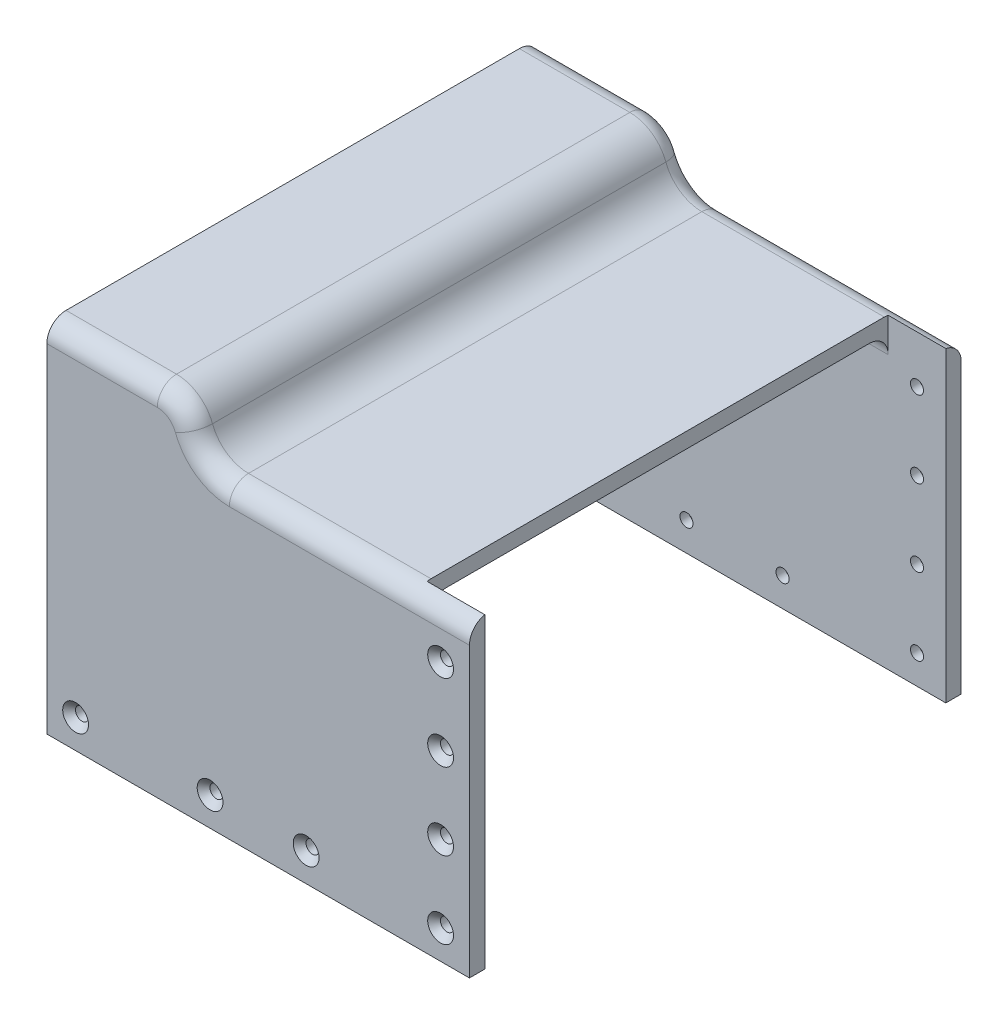
from build123d import *

# Parameters (mm, degrees)
BOSS_EXTRUDE1_DEPTH          = 64
SHELL1_T                     = -4
FILLET1_R                    = 10
FILLET2_R                    = 10
FILLET4_R                    = 10
FILLET6_R                    = 10
SKETCH3_W                    = 95
SKETCH3_H                    = 4
BOSS_EXTRUDE4_DEPTH          = 15
SKETCH4_W                    = 4
SKETCH4_H                    = 80
BOSS_EXTRUDE5_DEPTH          = 15
FILLET7_R                    = 5
FILLET8_R                    = 5
CSK_FOR_M3_SFHCS1_AT_2_COUNT = 2
CSK_FOR_M3_SFHCS1_AT_2_PITCH = 35
CSK_FOR_M3_SFHCS1_AT_3_COUNT = 2
CSK_FOR_M3_SFHCS1_AT_3_PITCH = 60
CSK_FOR_M3_SFHCS1_AT_4_COUNT = 2
CSK_FOR_M3_SFHCS1_AT_4_PITCH = 95
CSK_FOR_M3_SFHCS1_AT_5_COUNT = 2
CSK_FOR_M3_SFHCS1_AT_5_PITCH = 97.082439195
CSK_FOR_M3_SFHCS1_AT_6_COUNT = 2
CSK_FOR_M3_SFHCS1_AT_6_PITCH = 103.07764064
CSK_FOR_M3_SFHCS1_AT_7_COUNT = 2
CSK_FOR_M3_SFHCS1_AT_7_PITCH = 112.361025271


with BuildPart() as part:
    # Sketch1 → Boss-Extrude1 (new, symmetric)
    with BuildSketch(Plane.XY):
        Polygon((-47.5, -32.5), (47.5, -32.5), (47.5, 32.5), (-10, 32.5), (-10, 45.5), (-47.5, 45.5), (-47.5, 32.5), align=None)
    extrude(amount=BOSS_EXTRUDE1_DEPTH, both=True)

    # Shell1
    shell1_openings = [part.faces().sort_by_distance(p)[0] for p in [
        (47.5, 0, 0),
        (-47.5, 6.5, 0),
        (0, -32.5, 0),
    ]]
    offset(amount=SHELL1_T, openings=shell1_openings, kind=Kind.INTERSECTION)

    # Fillet1
    fillet1_edges = [part.edges().sort_by_distance(p)[0] for p in [
        (-10, 32.5, 0),
    ]]
    fillet(fillet1_edges, radius=FILLET1_R)

    # Fillet2
    fillet2_edges = [part.edges().sort_by_distance(p)[0] for p in [
        (-10, 45.5, 0),
    ]]
    fillet(fillet2_edges, radius=FILLET2_R)

    # Fillet4
    fillet4_edges = [part.edges().sort_by_distance(p)[0] for p in [
        (-14, 28.5, 0),
    ]]
    fillet(fillet4_edges, radius=FILLET4_R)

    # Fillet6
    fillet6_edges = [part.edges().sort_by_distance(p)[0] for p in [
        (-14, 41.5, 0),
    ]]
    fillet(fillet6_edges, radius=FILLET6_R)

    # Sketch3 → Boss-Extrude4 (add)
    with BuildSketch(Plane.XZ.offset(32.5)):
        with Locations((0, 62)):
            Rectangle(SKETCH3_W, SKETCH3_H)
        with Locations((0, -62)):
            Rectangle(SKETCH3_W, SKETCH3_H)
    extrude(amount=BOSS_EXTRUDE4_DEPTH)

    # Sketch4 → Boss-Extrude5 (add)
    with BuildSketch(Plane.ZY.offset(-47.5)):
        with Locations((62, -7.5)):
            Rectangle(SKETCH4_W, SKETCH4_H)
        with Locations((-62, -7.5)):
            Rectangle(SKETCH4_W, SKETCH4_H)
    extrude(amount=-BOSS_EXTRUDE5_DEPTH)

    # Fillet7
    fillet7_edges = [part.edges().sort_by_distance(p)[0] for p in [
        (21.75, 28.5, 60),
        (-9.700877125, 30.284161637, 60),
        (21.75, 28.5, -60),
        (-9.700877125, 30.284161637, -60),
        (-35.117496998, 41.5, 60),
        (-35.117496998, 41.5, -60),
        (-17.03411687, 39.715838363, 60),
        (-17.03411687, 39.715838363, -60),
    ]]
    fillet(fillet7_edges, radius=FILLET7_R)

    # Fillet8
    fillet8_edges = [part.edges().sort_by_distance(p)[0] for p in [
        (-33.117496998, 45.5, -64),
        (-5.700877125, 34.284161637, -64),
        (-33.117496998, 45.5, 64),
        (-5.700877125, 34.284161637, 64),
        (31.25, 32.5, -64),
        (31.25, 32.5, 64),
        (-13.03411687, 43.715838363, -64),
        (-13.03411687, 43.715838363, 64),
    ]]
    fillet(fillet8_edges, radius=FILLET8_R)

    # Sketch6 → CSK for M3 SFHCS1 (revolve, cut)
    with BuildSketch(Plane(origin=(-40, -40, -64), x_dir=(0, 1, 0), z_dir=(1, 0, 0))):
        Polygon((0, 0), (0, 16.021463052), (1.7, 15), (1.7, 1.66), (3.36, 0), align=None)
    csk_for_m3_sfhcs1 = revolve(axis=Axis((-40, -40, -70.35), (0, 0, 1)), mode=Mode.SUBTRACT)

    # CSK for M3 SFHCS1 at 2: CSK for M3 SFHCS1 ×2
    with Locations(*[(i * CSK_FOR_M3_SFHCS1_AT_2_PITCH, 0, 0) for i in range(1, CSK_FOR_M3_SFHCS1_AT_2_COUNT)]):
        add(csk_for_m3_sfhcs1, mode=Mode.SUBTRACT)

    # CSK for M3 SFHCS1 at 3: CSK for M3 SFHCS1 ×2
    with Locations(*[(i * CSK_FOR_M3_SFHCS1_AT_3_PITCH, 0, 0) for i in range(1, CSK_FOR_M3_SFHCS1_AT_3_COUNT)]):
        add(csk_for_m3_sfhcs1, mode=Mode.SUBTRACT)

    # CSK for M3 SFHCS1 at 4: CSK for M3 SFHCS1 ×2
    with Locations(*[(i * CSK_FOR_M3_SFHCS1_AT_4_PITCH, 0, 0) for i in range(1, CSK_FOR_M3_SFHCS1_AT_4_COUNT)]):
        add(csk_for_m3_sfhcs1, mode=Mode.SUBTRACT)

    # CSK for M3 SFHCS1 at 5: CSK for M3 SFHCS1 ×2
    with Locations(*[Vector(0.978549784986749, 0.2060104810498419, 0) * (i * CSK_FOR_M3_SFHCS1_AT_5_PITCH) for i in range(1, CSK_FOR_M3_SFHCS1_AT_5_COUNT)]):
        add(csk_for_m3_sfhcs1, mode=Mode.SUBTRACT)

    # CSK for M3 SFHCS1 at 6: CSK for M3 SFHCS1 ×2
    with Locations(*[Vector(0.9216353751380653, 0.3880570000581328, 0) * (i * CSK_FOR_M3_SFHCS1_AT_6_PITCH) for i in range(1, CSK_FOR_M3_SFHCS1_AT_6_COUNT)]):
        add(csk_for_m3_sfhcs1, mode=Mode.SUBTRACT)

    # CSK for M3 SFHCS1 at 7: CSK for M3 SFHCS1 ×2
    with Locations(*[Vector(0.8454889030309711, 0.5339929913879818, 0) * (i * CSK_FOR_M3_SFHCS1_AT_7_PITCH) for i in range(1, CSK_FOR_M3_SFHCS1_AT_7_COUNT)]):
        add(csk_for_m3_sfhcs1, mode=Mode.SUBTRACT)

    # Mirror1: CSK for M3 SFHCS1 across plane
    add(csk_for_m3_sfhcs1.mirror(Plane.XY), mode=Mode.SUBTRACT)

    # Mirror1 copy 1 sketch → Mirror1 copy 1 (revolve, cut)
    with BuildSketch(Plane(origin=(-5, -40, 64), x_dir=(0, 1, 0), z_dir=(1, 0, 0))):
        Polygon((0, 0), (0, -16.021463052), (1.7, -15), (1.7, -1.66), (3.36, 0), align=None)
    revolve(axis=Axis((-5, -40, 70.35), (0, 0, 1)), mode=Mode.SUBTRACT)

    # Mirror1 copy 2 sketch → Mirror1 copy 2 (revolve, cut)
    with BuildSketch(Plane(origin=(20, -40, 64), x_dir=(0, 1, 0), z_dir=(1, 0, 0))):
        Polygon((0, 0), (0, -16.021463052), (1.7, -15), (1.7, -1.66), (3.36, 0), align=None)
    revolve(axis=Axis((20, -40, 70.35), (0, 0, 1)), mode=Mode.SUBTRACT)

    # Mirror1 copy 3 sketch → Mirror1 copy 3 (revolve, cut)
    with BuildSketch(Plane(origin=(55, -40, 64), x_dir=(0, 1, 0), z_dir=(1, 0, 0))):
        Polygon((0, 0), (0, -16.021463052), (1.7, -15), (1.7, -1.66), (3.36, 0), align=None)
    revolve(axis=Axis((55, -40, 70.35), (0, 0, 1)), mode=Mode.SUBTRACT)

    # Mirror1 copy 4 sketch → Mirror1 copy 4 (revolve, cut)
    with BuildSketch(Plane(origin=(55, -20, 64), x_dir=(0, 1, 0), z_dir=(1, 0, 0))):
        Polygon((0, 0), (0, -16.021463052), (1.7, -15), (1.7, -1.66), (3.36, 0), align=None)
    revolve(axis=Axis((55, -20, 70.35), (0, 0, 1)), mode=Mode.SUBTRACT)

    # Mirror1 copy 5 sketch → Mirror1 copy 5 (revolve, cut)
    with BuildSketch(Plane(origin=(55, 0, 64), x_dir=(0, 1, 0), z_dir=(1, 0, 0))):
        Polygon((0, 0), (0, -16.021463052), (1.7, -15), (1.7, -1.66), (3.36, 0), align=None)
    revolve(axis=Axis((55, 0, 70.35), (0, 0, 1)), mode=Mode.SUBTRACT)

    # Mirror1 copy 6 sketch → Mirror1 copy 6 (revolve, cut)
    with BuildSketch(Plane(origin=(55, 20, 64), x_dir=(0, 1, 0), z_dir=(1, 0, 0))):
        Polygon((0, 0), (0, -16.021463052), (1.7, -15), (1.7, -1.66), (3.36, 0), align=None)
    revolve(axis=Axis((55, 20, 70.35), (0, 0, 1)), mode=Mode.SUBTRACT)


solid = part.part
